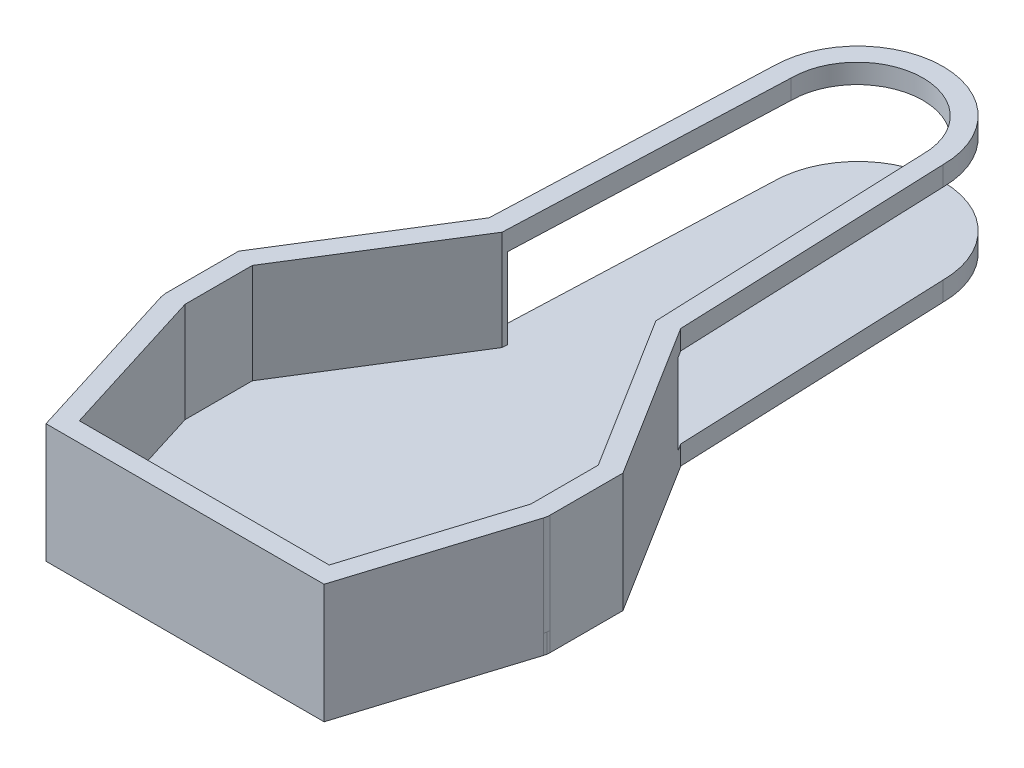
from build123d import *

# Parameters (mm, degrees)
BOSS_EXTRUDE1_DEPTH     = 33.02
BOSS_EXTRUDE2_START     = 6.35
BOSS_EXTRUDE2_DEPTH     = 6.35
CUT_EXTRUDE1_DEPTH      = 96.52
CUT_EXTRUDE1_DEPTH_BACK = 96.52
SKETCH3_W               = 138.649472244
SKETCH3_H               = 26.596699


with BuildPart() as part:
    # Sketch1 → Boss-Extrude1 (new body)
    with BuildSketch(Plane(origin=(0, 0, 0), x_dir=(1, 0, 0), z_dir=(0, 1, 0))):
        with BuildLine():
            Line((-22.221083262, 74.846156038), (-22.221083262, 50.8))
            Line((-22.221083262, 50.8), (-21.932164151, 48.906379538))
            Line((-21.932164151, 48.906379538), (-4.668805876, -6.35))
            Line((-4.668805876, -6.35), (87.218118757, -6.35))
            Line((87.218118757, -6.35), (104.489731546, 48.905528077))
            ThreePointArc((104.489731546, 48.905528077), (104.706204131, 49.841791784), (104.778916738, 50.8))
            Line((104.778916738, 50.8), (104.778916738, 74.846156038))
            Line((104.778916738, 74.846156038), (72.957581245, 125.760292827))
            Line((72.957581245, 125.760292827), (69.402851201, 215.965853579))
            ThreePointArc((69.402851201, 215.965853579), (41.278916738, 244.089788041), (13.154982275, 215.965853579))
            Line((13.154982275, 215.965853579), (9.600252232, 125.760292827))
            Line((9.600252232, 125.760292827), (-22.221083262, 74.846156038))
        make_face()
        with BuildLine():
            Line((82.55, 0), (0, 0))
            Line((0, 0), (-15.871083262, 50.8))
            Line((-15.871083262, 50.8), (-15.871083262, 73.025))
            Line((-15.871083262, 73.025), (15.878916738, 123.825))
            Line((15.878916738, 123.825), (19.500057517, 215.715813233))
            ThreePointArc((19.500057517, 215.715813233), (41.278916738, 237.494672454), (63.057775959, 215.715813233))
            Line((63.057775959, 215.715813233), (66.678916738, 123.825))
            Line((66.678916738, 123.825), (98.428916738, 73.025))
            Line((98.428916738, 73.025), (98.428916738, 50.8))
            Line((98.428916738, 50.8), (82.55, 0))
        make_face(mode=Mode.SUBTRACT)
    extrude(amount=BOSS_EXTRUDE1_DEPTH)

    # Sketch2 → Boss-Extrude2 (add)
    with BuildSketch(Plane.XZ.offset(BOSS_EXTRUDE2_START)):
        with BuildLine():
            Line((87.218118757, 6.35), (-4.668805876, 6.35))
            Line((-4.668805876, 6.35), (-21.932164151, -48.906379538))
            Line((-21.932164151, -48.906379538), (-22.221083262, -50.8))
            Line((-22.221083262, -50.8), (-22.221083262, -74.846156038))
            Line((-22.221083262, -74.846156038), (9.600252232, -125.760292827))
            Line((9.600252232, -125.760292827), (13.154982275, -215.965853579))
            ThreePointArc((13.154982275, -215.965853579), (41.278916738, -244.089788041), (69.402851201, -215.965853579))
            Line((69.402851201, -215.965853579), (72.957581245, -125.760292827))
            Line((72.957581245, -125.760292827), (104.778916738, -74.846156038))
            Line((104.778916738, -74.846156038), (104.778916738, -50.8))
            Line((104.778916738, -50.8), (104.706204131, -49.841791784))
            Line((104.706204131, -49.841791784), (104.489731546, -48.905528077))
            Line((104.489731546, -48.905528077), (87.218118757, 6.35))
        make_face()
    extrude(amount=-BOSS_EXTRUDE2_DEPTH)

    # Sketch3 → Cut-Extrude1 (cut, two sides: drawn at the far end of the back side and taken through both)
    with BuildSketch(Plane(origin=(4.637215869, 0, 0.182738741), x_dir=(-0.03937643239096595, 0, 0.9992244475452748), z_dir=(-0.9992244475452748, 0, -0.03937643239096595)).offset(-CUT_EXTRUDE1_DEPTH_BACK)):
        with Locations((-195.365518928, 13.2983495)):
            Rectangle(SKETCH3_W, SKETCH3_H)
    extrude(amount=CUT_EXTRUDE1_DEPTH + CUT_EXTRUDE1_DEPTH_BACK, mode=Mode.SUBTRACT)


solid = part.part
